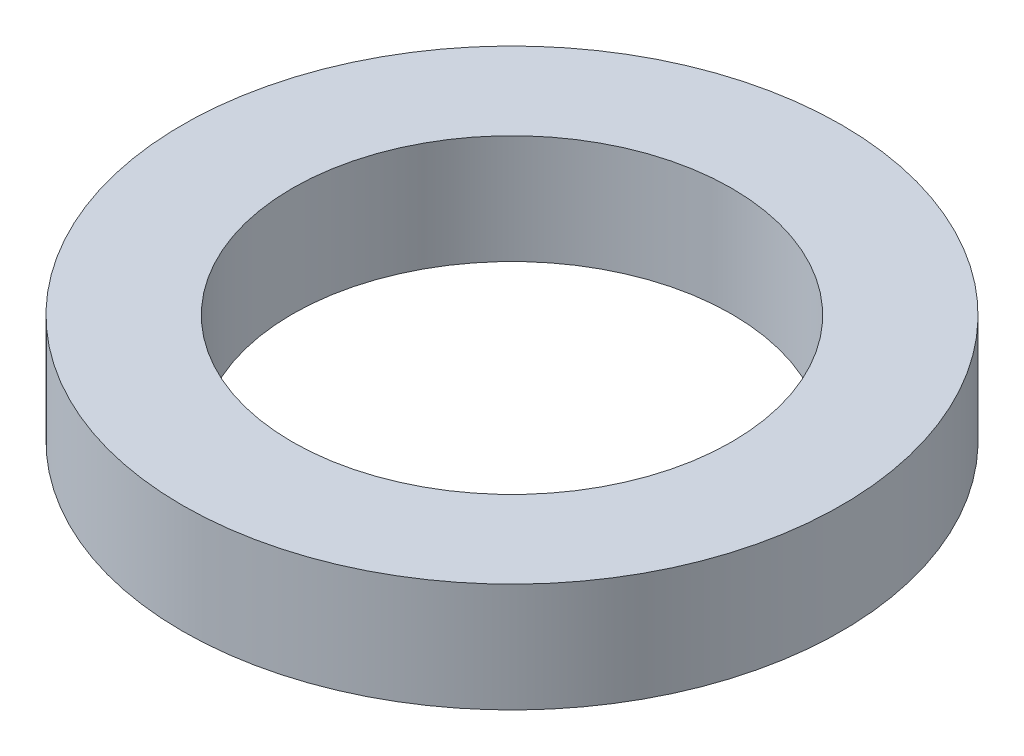
from build123d import *

# Parameters (mm, degrees)
SKETCH1_R           = 4.7625
SKETCH1_R_2         = 3.175
BOSS_EXTRUDE1_DEPTH = 1.5748


with BuildPart() as part:
    # Sketch1 → Boss-Extrude1 (new body)
    with BuildSketch(Plane(origin=(0, 0, 0), x_dir=(1, 0, 0), z_dir=(0, 1, 0))):
        with Locations(Location((0, 0, 0), (0, 0, 270))):
            Circle(SKETCH1_R)
        with Locations(Location((0, 0, 0), (0, 0, 270))):
            Circle(SKETCH1_R_2, mode=Mode.SUBTRACT)
    extrude(amount=BOSS_EXTRUDE1_DEPTH)


solid = part.part
